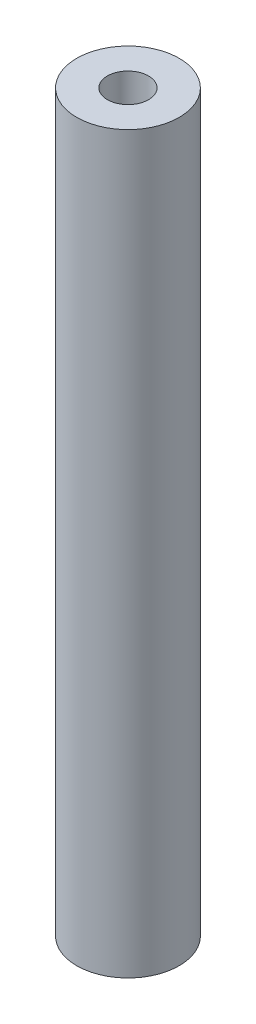
from build123d import *

# Parameters (mm, degrees)
SKETCH1_R                   = 6.35
BOSS_EXTRUDE1_DEPTH         = 91.0844
F_1_4_20_TAPPED_HOLE1_D     = 5.1054
F_1_4_20_TAPPED_HOLE1_DEPTH = 25.4
F_1_4_20_TAPPED_HOLE1_TIP   = 1.533816902
F_1_4_20_TAPPED_HOLE2_D     = 5.1054
F_1_4_20_TAPPED_HOLE2_DEPTH = 25.4
F_1_4_20_TAPPED_HOLE2_TIP   = 1.533816902


with BuildPart() as part:
    # Sketch1 → Boss-Extrude1 (new body)
    with BuildSketch(Plane(origin=(0, 0, 0), x_dir=(1, 0, 0), z_dir=(0, 1, 0))):
        with Locations(Location((0, 0, 0), (0, 0, 270))):
            Circle(SKETCH1_R)
    extrude(amount=BOSS_EXTRUDE1_DEPTH)

    # 1/4-20 Tapped Hole1
    with Locations(Plane(origin=(0, 91.0844, 0), x_dir=(1, 0, 0), z_dir=(0, 1, 0))):
        with Locations((0, 0)):
            Hole(F_1_4_20_TAPPED_HOLE1_D / 2, depth=F_1_4_20_TAPPED_HOLE1_DEPTH)
            with Locations((0, 0, -(F_1_4_20_TAPPED_HOLE1_DEPTH + F_1_4_20_TAPPED_HOLE1_TIP / 2))):  # 118° drill point
                Cone(0, F_1_4_20_TAPPED_HOLE1_D / 2, F_1_4_20_TAPPED_HOLE1_TIP, mode=Mode.SUBTRACT)

    # 1/4-20 Tapped Hole2
    with Locations(Plane(origin=(0, 0, 0), x_dir=(-1, 0, 0), z_dir=(0, -1, 0))):
        with Locations((0, 0)):
            Hole(F_1_4_20_TAPPED_HOLE2_D / 2, depth=F_1_4_20_TAPPED_HOLE2_DEPTH)
            with Locations((0, 0, -(F_1_4_20_TAPPED_HOLE2_DEPTH + F_1_4_20_TAPPED_HOLE2_TIP / 2))):  # 118° drill point
                Cone(0, F_1_4_20_TAPPED_HOLE2_D / 2, F_1_4_20_TAPPED_HOLE2_TIP, mode=Mode.SUBTRACT)


solid = part.part
